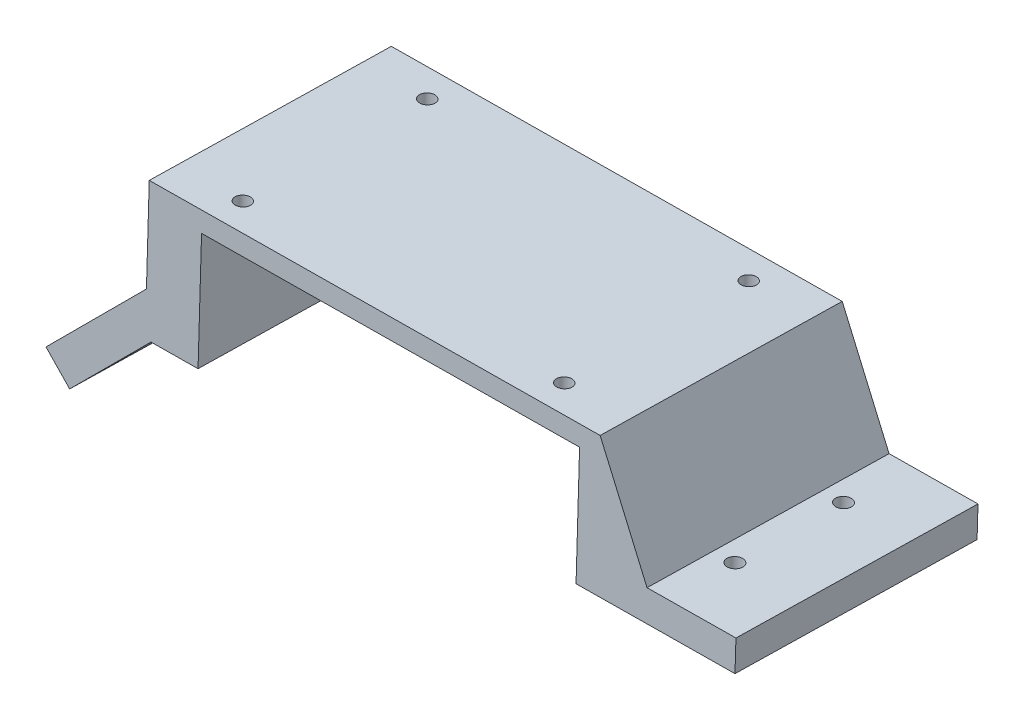
from build123d import *

# Parameters (mm, degrees)
BOSS_EXTRUDE2_DEPTH = 53.34
SKETCH4_R           = 1.7
CUT_EXTRUDE1_DEPTH  = 92.181462139
SKETCH5_R           = 1.65
CUT_EXTRUDE2_DEPTH  = 219.815917306
CUT_EXTRUDE3_REACH  = 101.921
SKETCH6_R           = 1.65548177
SKETCH6_R_2         = 1.651


with BuildPart() as part:
    # Sketch3 → Boss-Extrude2 (new body)
    with BuildSketch(Plane(origin=(0.39856693, 1.174139675, 38.425283804), x_dir=(0.9999462474151822, -0.00015834992252811985, -0.010367121374682776), z_dir=(0.010367121374682774, 0.030540538135663202, 0.999479763839562))):
        Polygon((35.811663947, 184.686461522), (70.101663947, 184.686461522), (70.101663947, 191.325794663), (50.92397302, 191.325794663), (40.119315635, 214.372267387), (-57.15, 214.372267387), (-57.15, 194.173966846), (-78.183444815, 173.140522031), (-72.925707516, 167.882784732), (-55.896794471, 184.911697776), (-45.736794471, 184.911697776), (-45.736794471, 210.086461522), (35.811663947, 210.086461522), align=None)
    extrude(amount=-BOSS_EXTRUDE2_DEPTH)

    # Sketch4 → Cut-Extrude1 (cut, through all)
    with BuildSketch(Plane(origin=(-0.030296425, 191.236544322, -5.843192728), x_dir=(0.999999987462651, 0.00015827605687458352, -4.836091908386067e-06), z_dir=(-0.0001583499225282815, 0.99953351642438, -0.030540538135663205))):
        with Locations(Location((55.718705533, -23.165573574, 0), (0, 0, 270))):
            Circle(SKETCH4_R)
        with Locations(Location((55.470585341, 0.766513873, 0), (0, 0, 270))):
            Circle(SKETCH4_R)
    extrude(amount=-CUT_EXTRUDE1_DEPTH, mode=Mode.SUBTRACT)

    # Sketch5 → Cut-Extrude2 (cut, through all)
    with BuildSketch(Plane(origin=(-125.675127332, 125.623262737, -2.535031563), x_dir=(-0.010088789926051056, 0.010084626405281995, 0.9998982531378351), z_dir=(-0.7071807426733389, 0.7068888977909322, -0.014264759791391517))):
        with Locations(Location((27.353288467, 72.760478035, 0), (0, 0, 270))):
            Circle(SKETCH5_R)
        with Locations(Location((17.431171, 84.018164474, 0), (0, 0, 90))):
            Circle(SKETCH5_R)
        with Locations(Location((2.224674143, 84.018164474, 0), (0, 0, 270))):
            Circle(SKETCH5_R)
        with Locations(Location((-7.697443324, 72.760478035, 0), (0, 0, 90))):
            Circle(SKETCH5_R)
    extrude(amount=-CUT_EXTRUDE2_DEPTH, mode=Mode.SUBTRACT)

    # Sketch6 → Cut-Extrude3 (cut, up to next)
    with BuildSketch(Plane(origin=(-0.033945832, 214.272266245, -6.547044407), x_dir=(0.999999987462651, 0.00015827605687420668, -4.836091908374553e-06), z_dir=(-0.00015834992252790448, 0.99953351642438, -0.030540538135663216)), mode=Mode.PRIVATE) as cut_extrude3_sk1:
        with Locations(Location((-43.266263609, 8.096604069, 0), (0, 0, 270))):
            Circle(SKETCH6_R)
    cut_extrude3_tool1 = extrude(cut_extrude3_sk1.sketch, amount=-CUT_EXTRUDE3_REACH, mode=Mode.PRIVATE) & part.part
    # Sketch6 → Cut-Extrude3 (cut, up to next)
    with BuildSketch(Plane(origin=(-0.033945832, 214.272266245, -6.547044407), x_dir=(0.999999987462651, 0.00015827605687420668, -4.836091908374553e-06), z_dir=(-0.00015834992252790448, 0.99953351642438, -0.030540538135663216)), mode=Mode.PRIVATE) as cut_extrude3_sk2:
        with Locations(Location((26.072009948, 8.815481008, 0), (0, 0, 270))):
            Circle(SKETCH6_R_2)
    cut_extrude3_tool2 = extrude(cut_extrude3_sk2.sketch, amount=-CUT_EXTRUDE3_REACH, mode=Mode.PRIVATE) & part.part
    # Sketch6 → Cut-Extrude3 (cut, up to next)
    with BuildSketch(Plane(origin=(-0.033945832, 214.272266245, -6.547044407), x_dir=(0.999999987462651, 0.00015827605687420668, -4.836091908374553e-06), z_dir=(-0.00015834992252790448, 0.99953351642438, -0.030540538135663216)), mode=Mode.PRIVATE) as cut_extrude3_sk3:
        with Locations(Location((26.493329766, -31.822334996, 0), (0, 0, 270))):
            Circle(SKETCH6_R_2)
    cut_extrude3_tool3 = extrude(cut_extrude3_sk3.sketch, amount=-CUT_EXTRUDE3_REACH, mode=Mode.PRIVATE) & part.part
    # Sketch6 → Cut-Extrude3 (cut, up to next)
    with BuildSketch(Plane(origin=(-0.033945832, 214.272266245, -6.547044407), x_dir=(0.999999987462651, 0.00015827605687420668, -4.836091908374553e-06), z_dir=(-0.00015834992252790448, 0.99953351642438, -0.030540538135663216)), mode=Mode.PRIVATE) as cut_extrude3_sk4:
        with Locations(Location((-42.844943791, -32.541211936, 0), (0, 0, 270))):
            Circle(SKETCH6_R_2)
    cut_extrude3_tool4 = extrude(cut_extrude3_sk4.sketch, amount=-CUT_EXTRUDE3_REACH, mode=Mode.PRIVATE) & part.part
    add(cut_extrude3_tool1.solids().sort_by_distance((-43.300209, 214.018144, -14.639662))[0], mode=Mode.SUBTRACT)
    add(cut_extrude3_tool2.solids().sort_by_distance((26.038064, 214.007163, -15.358539))[0], mode=Mode.SUBTRACT)
    add(cut_extrude3_tool3.solids().sort_by_distance((26.459384, 215.248331, 25.260318))[0], mode=Mode.SUBTRACT)
    add(cut_extrude3_tool4.solids().sort_by_distance((-42.878889, 215.259311, 25.979195))[0], mode=Mode.SUBTRACT)


solid = part.part
